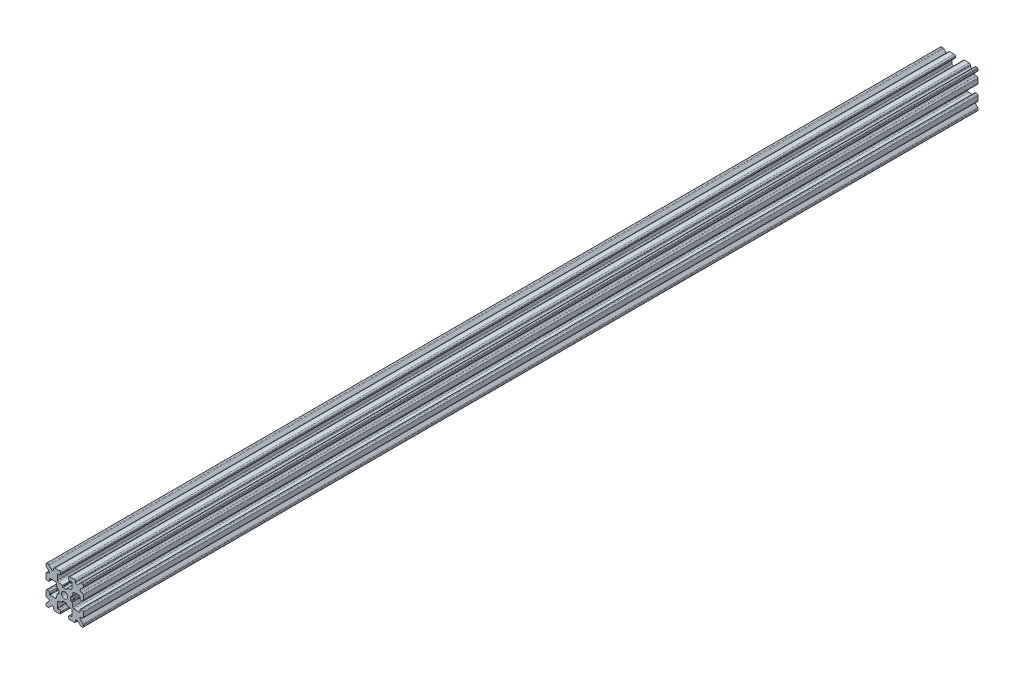
from build123d import *

# Parameters (mm, degrees)
SKETCH1_W           = 15
SKETCH1_H           = 15
SKETCH1_R           = 1.25
BOSS_EXTRUDE1_DEPTH = 180
FILLET1_R           = 0.25
CUT_EXTRUDE1_DEPTH  = 361.156216106
CUT_EXTRUDE3_DEPTH  = 361.156216106
FILLET3_R           = 0.5
FILLET4_R           = 0.5
FILLET5_R           = 3
FILLET6_R           = 0.2
CUT_EXTRUDE4_DEPTH  = 361.156216106
FILLET8_R           = 0.5
SKETCH6_W           = 5.1529354
SKETCH6_H           = 1.651
SKETCH6_W_2         = 1.651
SKETCH6_H_2         = 5.1529354
CUT_EXTRUDE5_DEPTH  = 361.156216106
FILLET10_R          = 0.2


with BuildPart() as part:
    # Sketch1 → Boss-Extrude1 (new, symmetric)
    with BuildSketch(Plane.XY):
        Rectangle(SKETCH1_W, SKETCH1_H)
        Circle(SKETCH1_R, mode=Mode.SUBTRACT)
    extrude(amount=BOSS_EXTRUDE1_DEPTH, both=True)

    # Fillet1
    fillet1_edges = [part.edges().sort_by_distance(p)[0] for p in [
        (7.5, -7.5, 0),
        (-7.5, -7.5, 0),
        (-7.5, 7.5, 0),
        (7.5, 7.5, 0),
    ]]
    fillet(fillet1_edges, radius=FILLET1_R)

    # Sketch2 → Cut-Extrude1 (cut, through all)
    with BuildSketch(Plane.XY.offset(180)):
        Polygon((-7.5, 1.6), (-6.1, 1.6), (-6.1, 2.9), (-3.4, 2.9), (-3.4, -2.9), (-6.1, -2.9), (-6.1, -1.6), (-7.5, -1.6), align=None)
        Polygon((2.9, 6.1), (1.6, 6.1), (1.6, 7.5), (-1.6, 7.5), (-1.6, 6.1), (-2.9, 6.1), (-2.9, 3.4), (2.9, 3.4), align=None)
        Polygon((-1.6, -7.5), (-1.6, -6.1), (-2.9, -6.1), (-2.9, -3.4), (2.9, -3.4), (2.9, -6.1), (1.6, -6.1), (1.6, -7.5), align=None)
        Polygon((6.1, -2.9), (6.1, -1.6), (7.5, -1.6), (7.5, 1.6), (6.1, 1.6), (6.1, 2.9), (3.4, 2.9), (3.4, -2.9), align=None)
    extrude(amount=-CUT_EXTRUDE1_DEPTH, mode=Mode.SUBTRACT)

    # Sketch4 → Cut-Extrude3 (cut, through all)
    with BuildSketch(Plane.XY.offset(180)):
        Polygon((-3.4, 2.9), (-2.75, 0), (-3.4, -2.9), align=None)
        Polygon((-2.9, 3.4), (0, 2.75), (2.9, 3.4), align=None)
        Polygon((3.4, 2.9), (2.75, 0), (3.4, -2.9), align=None)
        Polygon((-2.9, -3.4), (0, -2.75), (2.9, -3.4), align=None)
    extrude(amount=-CUT_EXTRUDE3_DEPTH, mode=Mode.SUBTRACT)

    # Fillet3
    fillet3_edges = [part.edges().sort_by_distance(p)[0] for p in [
        (1.6, -7.5, 0),
        (-1.6, -7.5, 0),
        (-1.6, -6.1, 0),
        (1.6, -6.1, 0),
        (6.1, 1.6, 0),
        (7.5, 1.6, 0),
        (7.5, -1.6, 0),
        (6.1, -1.6, 0),
        (-7.5, -1.6, 0),
        (-7.5, 1.6, 0),
        (-6.1, 1.6, 0),
        (-6.1, -1.6, 0),
        (-1.6, 6.1, 0),
        (-1.6, 7.5, 0),
        (1.6, 7.5, 0),
        (1.6, 6.1, 0),
    ]]
    fillet(fillet3_edges, radius=FILLET3_R)

    # Fillet4
    fillet4_edges = [part.edges().sort_by_distance(p)[0] for p in [
        (-2.9, -3.4, 0),
        (2.9, -3.4, 0),
        (3.4, -2.9, 0),
        (3.4, 2.9, 0),
        (-3.4, 2.9, 0),
        (-3.4, -2.9, 0),
        (2.9, 3.4, 0),
        (-2.9, 3.4, 0),
    ]]
    fillet(fillet4_edges, radius=FILLET4_R)

    # Fillet5
    fillet5_edges = [part.edges().sort_by_distance(p)[0] for p in [
        (-2.75, 0, 0),
        (0, 2.75, 0),
        (2.75, 0, 0),
        (0, -2.75, 0),
    ]]
    fillet(fillet5_edges, radius=FILLET5_R)

    # Fillet6
    fillet6_edges = [part.edges().sort_by_distance(p)[0] for p in [
        (-2.9, -6.1, 0),
        (2.9, -6.1, 0),
        (6.1, -2.9, 0),
        (6.1, 2.9, 0),
        (-6.1, 2.9, 0),
        (-6.1, -2.9, 0),
        (2.9, 6.1, 0),
        (-2.9, 6.1, 0),
    ]]
    fillet(fillet6_edges, radius=FILLET6_R)

    # Sketch5 → Cut-Extrude4 (cut, through all)
    with BuildSketch(Plane.XY.offset(180)):
        Polygon((-7.5, 6.439339828), (-5.460660172, 4.4), (-7.5, 4.4), align=None)
        Polygon((-6.439339828, 7.5), (-4.4, 5.460660172), (-4.4, 7.5), align=None)
        Polygon((4.4, 7.5), (6.439339828, 7.5), (4.4, 5.460660172), align=None)
        Polygon((7.5, 6.439339828), (7.5, 4.4), (5.460660172, 4.4), align=None)
        Polygon((7.5, -6.439339828), (5.460660172, -4.4), (7.5, -4.4), align=None)
        Polygon((6.439339828, -7.5), (4.4, -5.460660172), (4.4, -7.5), align=None)
        Polygon((-4.4, -7.5), (-6.439339828, -7.5), (-4.4, -5.460660172), align=None)
        Polygon((-7.5, -6.439339828), (-7.5, -4.4), (-5.460660172, -4.4), align=None)
    extrude(amount=-CUT_EXTRUDE4_DEPTH, mode=Mode.SUBTRACT)

    # Fillet8
    fillet8_edges = [part.edges().sort_by_distance(p)[0] for p in [
        (-7.5, 4.4, 0),
        (-7.5, 6.439339828, 0),
        (-5.460660172, 4.4, 0),
        (7.5, -4.4, 0),
        (7.5, -6.439339828, 0),
        (5.460660172, -4.4, 0),
        (5.460660172, 4.4, 0),
        (7.5, 6.439339828, 0),
        (7.5, 4.4, 0),
        (-4.4, 7.5, 0),
        (-4.4, 5.460660172, 0),
        (-6.439339828, 7.5, 0),
        (-5.460660172, -4.4, 0),
        (-7.5, -6.439339828, 0),
        (-7.5, -4.4, 0),
        (4.4, 5.460660172, 0),
        (4.4, 7.5, 0),
        (6.439339828, 7.5, 0),
        (6.439339828, -7.5, 0),
        (4.4, -7.5, 0),
        (4.4, -5.460660172, 0),
        (-6.439339828, -7.5, 0),
        (-4.4, -5.460660172, 0),
        (-4.4, -7.5, 0),
    ]]
    fillet(fillet8_edges, radius=FILLET8_R)

    # Sketch6 → Cut-Extrude5 (cut, through all)
    with BuildSketch(Plane.XY.offset(180)):
        with Locations((4.9235323, 0)):
            Rectangle(SKETCH6_W, SKETCH6_H)
        with Locations((0, -4.9235323)):
            Rectangle(SKETCH6_W_2, SKETCH6_H_2)
        with Locations((-4.9235323, 0)):
            Rectangle(SKETCH6_W, SKETCH6_H)
        with Locations((0, 4.9235323)):
            Rectangle(SKETCH6_W_2, SKETCH6_H_2)
    extrude(amount=-CUT_EXTRUDE5_DEPTH, mode=Mode.SUBTRACT)

    # Fillet10
    fillet10_edges = [part.edges().sort_by_distance(p)[0] for p in [
        (0.8255, -2.935025862, 0),
        (-0.8255, -2.935025862, 0),
        (0.8255, -2.3470646, 0),
        (-0.8255, -2.3470646, 0),
        (2.935025862, 0.8255, 0),
        (2.935025862, -0.8255, 0),
        (2.3470646, 0.8255, 0),
        (2.3470646, -0.8255, 0),
        (-2.935025862, -0.8255, 0),
        (-2.935025862, 0.8255, 0),
        (-2.3470646, -0.8255, 0),
        (-2.3470646, 0.8255, 0),
        (-0.8255, 2.935025862, 0),
        (0.8255, 2.935025862, 0),
        (-0.8255, 2.3470646, 0),
        (0.8255, 2.3470646, 0),
    ]]
    fillet(fillet10_edges, radius=FILLET10_R)


solid = part.part
